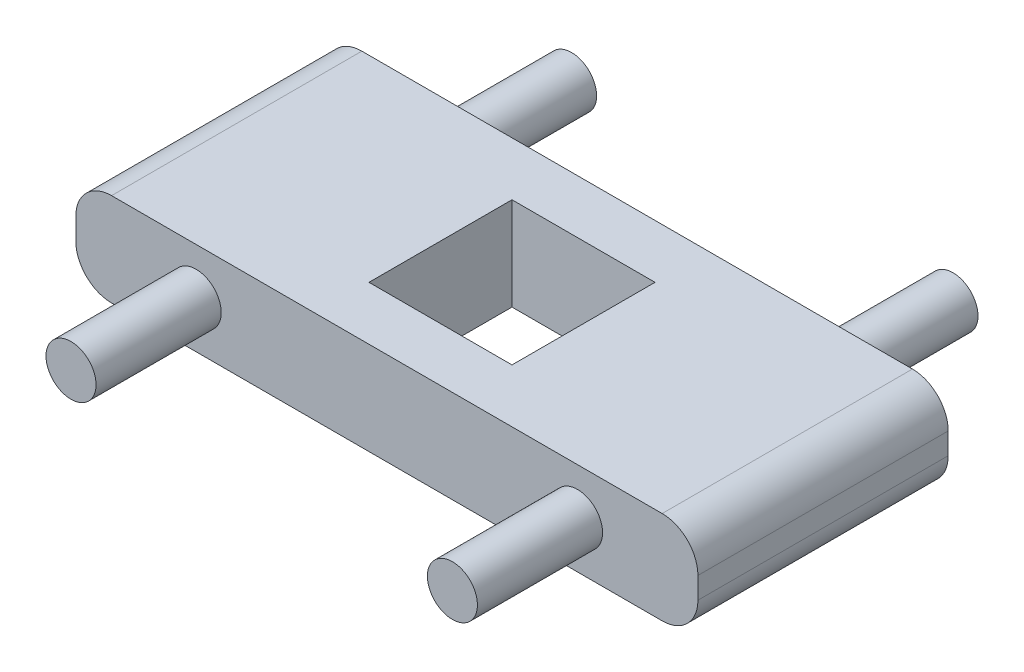
from build123d import *

# Parameters (mm, degrees)
SKETCH1_W           = 110.49
SKETCH1_H           = 44.45
SKETCH1_W_2         = 25.4
SKETCH1_H_2         = 25.4
BOSS_EXTRUDE1_DEPTH = 8.255
FILLET1_R           = 6.35
SKETCH2_R           = 4.445
BOSS_EXTRUDE2_DEPTH = 22.225
BOSS_EXTRUDE3_START = 22.225
SKETCH3_R           = 4.445
BOSS_EXTRUDE3_DEPTH = 22.225


with BuildPart() as part:
    # Sketch1 → Boss-Extrude1 (new, symmetric)
    with BuildSketch(Plane(origin=(0, 0, 0), x_dir=(1, 0, 0), z_dir=(0, 1, 0))):
        Rectangle(SKETCH1_W, SKETCH1_H)
        Rectangle(SKETCH1_W_2, SKETCH1_H_2, mode=Mode.SUBTRACT)
    extrude(amount=BOSS_EXTRUDE1_DEPTH, both=True)

    # Fillet1
    fillet1_edges = [part.edges().sort_by_distance(p)[0] for p in [
        (-55.245, 8.255, 0),
        (55.245, 8.255, 0),
        (-55.245, -8.255, 0),
        (55.245, -8.255, 0),
    ]]
    fillet(fillet1_edges, radius=FILLET1_R)

    # Sketch2 → Boss-Extrude2 (add)
    with BuildSketch(Plane.XY.offset(22.225)):
        with Locations(Location((-33.866666667, 0, 0), (0, 0, 180))):
            Circle(SKETCH2_R)
        with Locations(Location((33.866666667, 0, 0), (0, 0, 180))):
            Circle(SKETCH2_R)
    extrude(amount=BOSS_EXTRUDE2_DEPTH)

    # Sketch3 → Boss-Extrude3 (add)
    with BuildSketch(Plane(origin=(0, 0, -22.225), x_dir=(-1, 0, 0), z_dir=(0, 0, -1)).offset(BOSS_EXTRUDE3_START)):
        with Locations((-33.866666667, 0)):
            Circle(SKETCH3_R)
        with Locations((33.866666667, 0)):
            Circle(SKETCH3_R)
    extrude(amount=-BOSS_EXTRUDE3_DEPTH)


solid = part.part
